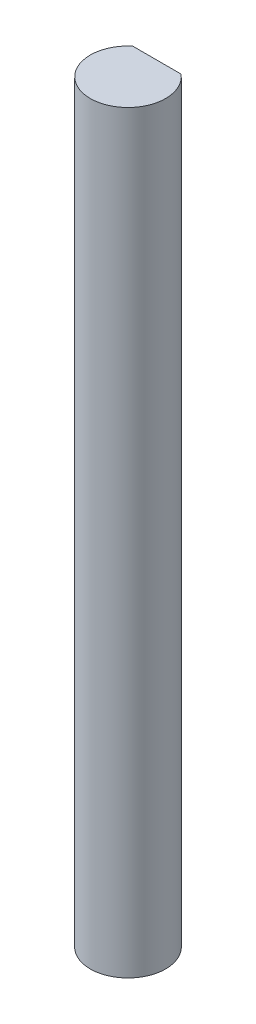
from build123d import *

# Parameters (mm, degrees)
SKETCH_1_R          = 3
EXTRUDE_1_DEPTH     = 60
SKETCH_2_W          = 5
SKETCH_2_H          = 2
CUT_EXTRUDE_1_DEPTH = 61.149812967


with BuildPart() as part:
    # Эскиз1 → Бобышка-Вытянуть1 (new body)
    with BuildSketch(Plane(origin=(0, 0, 0), x_dir=(1, 0, 0), z_dir=(0, 1, 0))):
        with Locations(Location((0, 0, 0), (0, 0, 270))):
            Circle(SKETCH_1_R)
    extrude(amount=EXTRUDE_1_DEPTH)

    # Эскиз2 → Вырез-Вытянуть1 (cut, through all)
    with BuildSketch(Plane(origin=(0, 60, 0), x_dir=(1, 0, 0), z_dir=(0, 1, 0))):
        with Locations((0, 3.3)):
            Rectangle(SKETCH_2_W, SKETCH_2_H)
    extrude(amount=-CUT_EXTRUDE_1_DEPTH, mode=Mode.SUBTRACT)


solid = part.part
